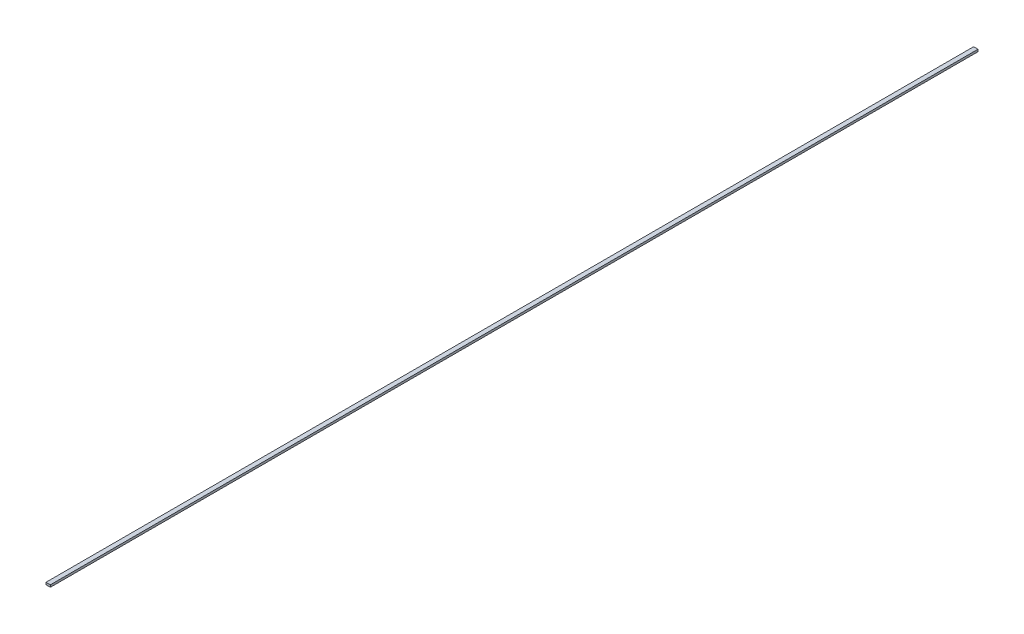
from build123d import *

# Parameters (mm, degrees)
SKETCH1_W           = 5
SKETCH1_H           = 2.5
BOSS_EXTRUDE1_DEPTH = 1060


with BuildPart() as part:
    # Sketch1 → Boss-Extrude1 (new body)
    with BuildSketch(Plane.XY):
        with Locations((2.5, 1.25)):
            Rectangle(SKETCH1_W, SKETCH1_H)
    extrude(amount=BOSS_EXTRUDE1_DEPTH)


solid = part.part
